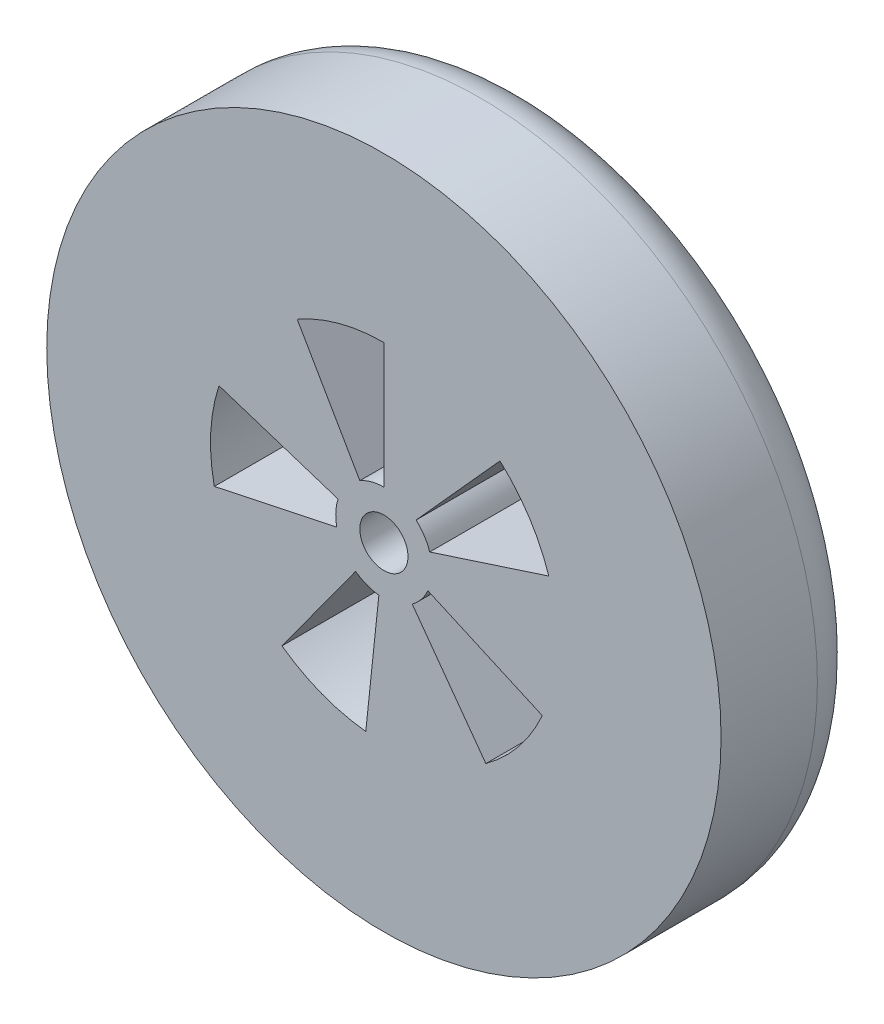
from build123d import *

# Parameters (mm, degrees)
SKETCH1_R           = 35
BOSS_EXTRUDE1_DEPTH = 15
SKETCH2_R           = 20
CUT_EXTRUDE1_DEPTH  = 3
FILLET2_R           = 2
SKETCH4_R           = 2.5
CUT_EXTRUDE2_DEPTH  = 51.931326313
CUT_EXTRUDE3_DEPTH  = 51.931326313
FILLET3_R           = 5


with BuildPart() as part:
    # Sketch1 → Boss-Extrude1 (new body)
    with BuildSketch(Plane.XY):
        Circle(SKETCH1_R)
    extrude(amount=BOSS_EXTRUDE1_DEPTH)

    # Sketch2 → Cut-Extrude1 (cut)
    with BuildSketch(Plane(origin=(0, 0, 0), x_dir=(-1, 0, 0), z_dir=(0, 0, -1))):
        Circle(SKETCH2_R)
    extrude(amount=-CUT_EXTRUDE1_DEPTH, mode=Mode.SUBTRACT)

    # Fillet2
    fillet2_edges = [part.edges().sort_by_distance(p)[0] for p in [
        (20, 0, 3),
    ]]
    fillet(fillet2_edges, radius=FILLET2_R)

    # Sketch4 → Cut-Extrude2 (cut, through all)
    with BuildSketch(Plane(origin=(0, 0, 3), x_dir=(-1, 0, 0), z_dir=(0, 0, -1))):
        Circle(SKETCH4_R)
    extrude(amount=-CUT_EXTRUDE2_DEPTH, mode=Mode.SUBTRACT)

    # Sketch5 → Cut-Extrude3 (cut, through all)
    with BuildSketch(Plane(origin=(0, 0, 3), x_dir=(-1, 0, 0), z_dir=(0, 0, -1))):
        with BuildLine():
            Line((0, 5), (0, 18))
            ThreePointArc((0, 18), (4.658742812, 17.386664873), (9, 15.588457268))
            Line((9, 15.588457268), (2.5, 4.330127019))
            ThreePointArc((2.5, 4.330127019), (1.294095226, 4.829629131), (0, 5))
        make_face()
        with BuildLine():
            Line((4.890738004, -1.039558454), (17.606656813, -3.742410435))
            ThreePointArc((17.606656813, -3.742410435), (17.975331626, 0.942047212), (17.119017293, 5.562305899))
            Line((17.119017293, 5.562305899), (4.755282581, 1.545084972))
            ThreePointArc((4.755282581, 1.545084972), (4.993147674, 0.261679781), (4.890738004, -1.039558454))
        make_face()
        with BuildLine():
            Line((0.522642316, -4.972609477), (1.881512339, -17.901394117))
            ThreePointArc((1.881512339, -17.901394117), (6.450623092, -16.804447677), (10.580134541, -14.562305899))
            Line((10.580134541, -14.562305899), (2.938926261, -4.045084972))
            ThreePointArc((2.938926261, -4.045084972), (1.791839748, -4.667902132), (0.522642316, -4.972609477))
        make_face()
        with BuildLine():
            Line((-4.567727288, -2.033683215), (-16.443818238, -7.321259575))
            ThreePointArc((-16.443818238, -7.321259575), (-13.988627306, -11.327767039), (-10.580134541, -14.562305899))
            Line((-10.580134541, -14.562305899), (-2.938926261, -4.045084972))
            ThreePointArc((-2.938926261, -4.045084972), (-3.885729807, -3.146601955), (-4.567727288, -2.033683215))
        make_face()
        with BuildLine():
            Line((-3.345653032, 3.715724127), (-12.044350914, 13.376606859))
            ThreePointArc((-12.044350914, 13.376606859), (-15.096070223, 9.80350263), (-17.119017293, 5.562305899))
            Line((-17.119017293, 5.562305899), (-4.755282581, 1.545084972))
            ThreePointArc((-4.755282581, 1.545084972), (-4.19335284, 2.723195175), (-3.345653032, 3.715724127))
        make_face()
    extrude(amount=-CUT_EXTRUDE3_DEPTH, mode=Mode.SUBTRACT)

    # Fillet3
    fillet3_edges = [part.edges().sort_by_distance(p)[0] for p in [
        (-35, 0, 0),
    ]]
    fillet(fillet3_edges, radius=FILLET3_R)


solid = part.part
